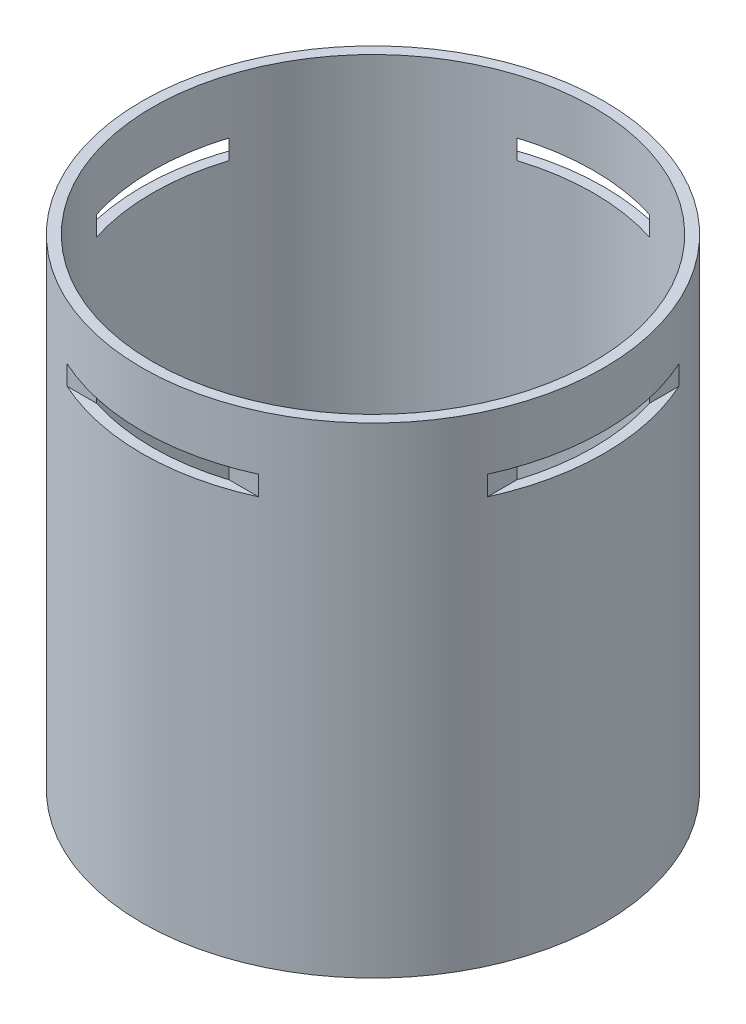
from build123d import *

# Parameters (mm, degrees)
SKETCH1_R           = 29.55
BOSS_EXTRUDE1_DEPTH = 61.5
SKETCH2_R           = 28.2
CUT_EXTRUDE1_DEPTH  = 61.5
CUT_EXTRUDE2_START  = -2.5
CUT_EXTRUDE2_DEPTH  = 2.5


with BuildPart() as part:
    # Sketch1 → Boss-Extrude1 (new body)
    with BuildSketch(Plane(origin=(0, 0, 0), x_dir=(1, 0, 0), z_dir=(0, 1, 0))):
        with Locations(Location((0, 0, 0), (0, 0, 270))):
            Circle(SKETCH1_R)
    extrude(amount=BOSS_EXTRUDE1_DEPTH)

    # Sketch2 → Cut-Extrude1 (cut)
    with BuildSketch(Plane(origin=(0, 61.5, 0), x_dir=(1, 0, 0), z_dir=(0, 1, 0))):
        with Locations(Location((0, 0, 0), (0, 0, 270))):
            Circle(SKETCH2_R)
    extrude(amount=-CUT_EXTRUDE1_DEPTH, mode=Mode.SUBTRACT)

    # Sketch3 → Cut-Extrude2 (cut)
    with BuildSketch(Plane(origin=(0, 54.50000003, 0), x_dir=(1, 0, 0), z_dir=(0, 1, 0)).offset(CUT_EXTRUDE2_START)):
        with BuildLine():
            Line((-12.25, 26.891262521), (12.25, 26.891262521))
            ThreePointArc((12.25, 26.891262521), (0, 29.55), (-12.25, 26.891262521))
        make_face()
        with BuildLine():
            Line((26.891262521, 12.25), (26.891262521, -12.25))
            ThreePointArc((26.891262521, -12.25), (29.55, 0), (26.891262521, 12.25))
        make_face()
        with BuildLine():
            Line((12.25, -26.891262521), (-12.25, -26.891262521))
            ThreePointArc((-12.25, -26.891262521), (0, -29.55), (12.25, -26.891262521))
        make_face()
        with BuildLine():
            Line((-26.891262521, -12.25), (-26.891262521, 12.25))
            ThreePointArc((-26.891262521, 12.25), (-29.55, 0), (-26.891262521, -12.25))
        make_face()
    extrude(amount=CUT_EXTRUDE2_DEPTH, mode=Mode.SUBTRACT)


solid = part.part
